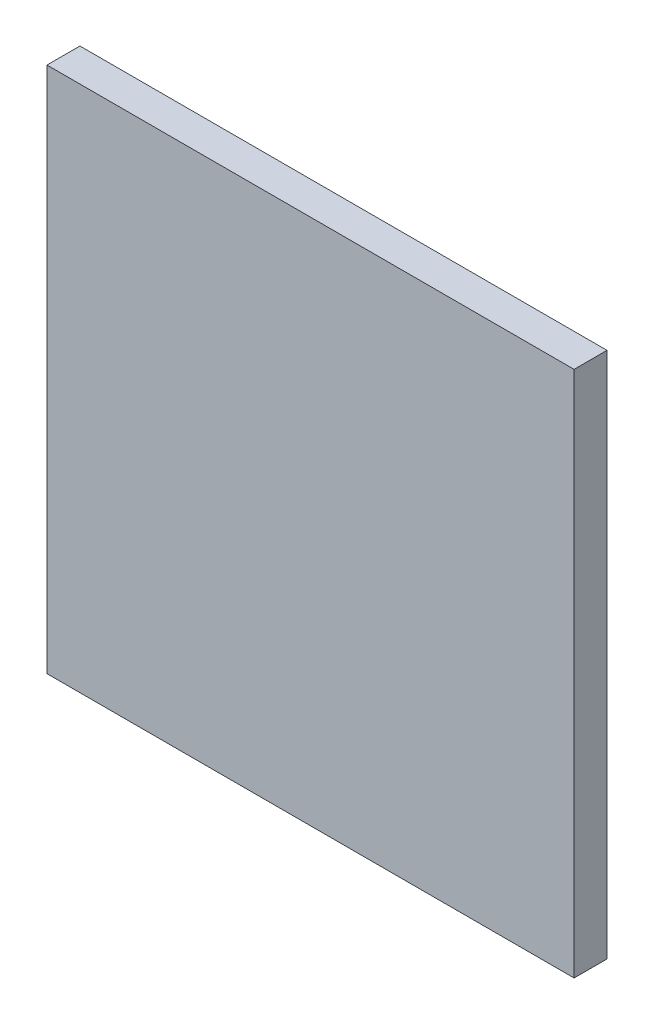
from build123d import *

# Parameters (mm, degrees)
SKETCH2_W      = 101.6
SKETCH2_H      = 101.6
EXTRUDE1_DEPTH = 6.35


with BuildPart() as part:
    # Sketch2 → Extrude1 (new body)
    with BuildSketch(Plane.XY):
        with Locations((50.8, 50.8)):
            Rectangle(SKETCH2_W, SKETCH2_H)
    extrude(amount=EXTRUDE1_DEPTH)


solid = part.part
